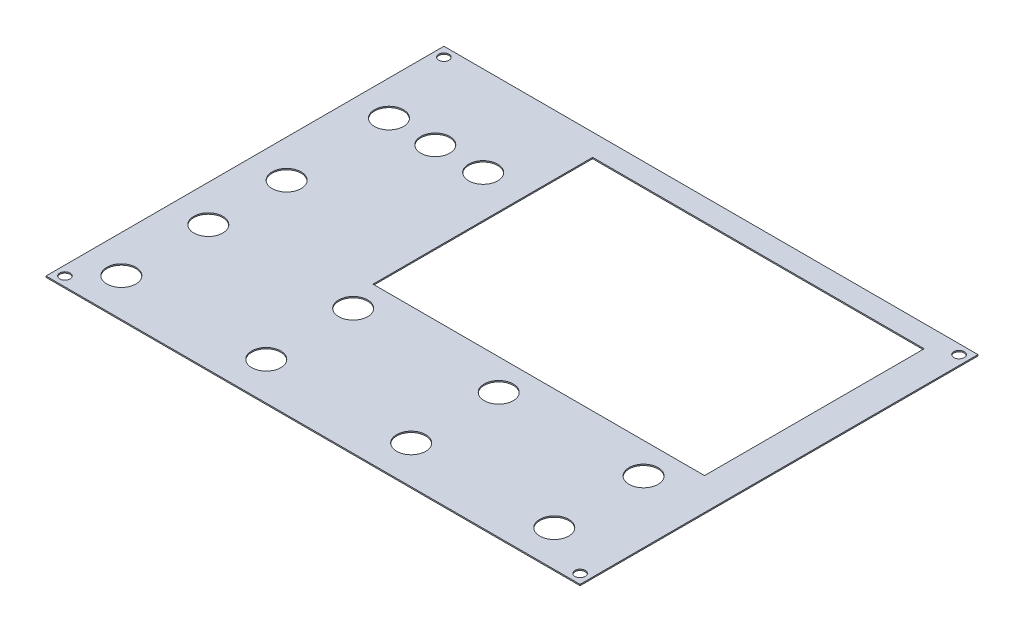
from build123d import *

# Parameters (mm, degrees)
SKETCH1_W           = 128.872
SKETCH1_H           = 96.012
SKETCH1_R           = 1.25
SKETCH1_R_2         = 3.5
SKETCH1_W_2         = 80
SKETCH1_H_2         = 53
BOSS_EXTRUDE1_DEPTH = 0.3


with BuildPart() as part:
    # Sketch1 → Boss-Extrude1 (new body)
    with BuildSketch(Plane(origin=(0, 0, 0), x_dir=(1, 0, 0), z_dir=(0, 1, 0))):
        with Locations((62.15, 45.72)):
            Rectangle(SKETCH1_W, SKETCH1_H)
        with Locations(Location((0, 91.44, 0), (0, 0, 270))):
            Circle(SKETCH1_R, mode=Mode.SUBTRACT)
        with Locations(Location((124.3, 91.44, 0), (0, 0, 270))):
            Circle(SKETCH1_R, mode=Mode.SUBTRACT)
        with Locations(Location((0, 0, 0), (0, 0, 270))):
            Circle(SKETCH1_R, mode=Mode.SUBTRACT)
        with Locations(Location((124.3, 0, 0), (0, 0, 270))):
            Circle(SKETCH1_R, mode=Mode.SUBTRACT)
        with Locations(Location((6.731, 6.881, 0), (0, 0, 270))):
            Circle(SKETCH1_R_2, mode=Mode.SUBTRACT)
        with Locations(Location((41.697, 6.881, 0), (0, 0, 270))):
            Circle(SKETCH1_R_2, mode=Mode.SUBTRACT)
        with Locations(Location((76.663, 6.881, 0), (0, 0, 270))):
            Circle(SKETCH1_R_2, mode=Mode.SUBTRACT)
        with Locations(Location((111.63, 6.44, 0), (0, 0, 270))):
            Circle(SKETCH1_R_2, mode=Mode.SUBTRACT)
        with Locations(Location((6.73, 46.754, 0), (0, 0, 270))):
            Circle(SKETCH1_R_2, mode=Mode.SUBTRACT)
        with Locations(Location((6.568, 28.023, 0), (0, 0, 270))):
            Circle(SKETCH1_R_2, mode=Mode.SUBTRACT)
        with Locations(Location((41.524, 28.023, 0), (0, 0, 270))):
            Circle(SKETCH1_R_2, mode=Mode.SUBTRACT)
        with Locations(Location((76.645, 28.023, 0), (0, 0, 270))):
            Circle(SKETCH1_R_2, mode=Mode.SUBTRACT)
        with Locations(Location((111.601, 28.023, 0), (0, 0, 270))):
            Circle(SKETCH1_R_2, mode=Mode.SUBTRACT)
        with Locations(Location((6.096, 72.09, 0), (0, 0, 270))):
            Circle(SKETCH1_R_2, mode=Mode.SUBTRACT)
        with Locations(Location((17.272, 72.09, 0), (0, 0, 270))):
            Circle(SKETCH1_R_2, mode=Mode.SUBTRACT)
        with Locations(Location((28.83, 72.09, 0), (0, 0, 270))):
            Circle(SKETCH1_R_2, mode=Mode.SUBTRACT)
        with Locations((78.875410923, 61.951987271)):
            Rectangle(SKETCH1_W_2, SKETCH1_H_2, mode=Mode.SUBTRACT)
    extrude(amount=BOSS_EXTRUDE1_DEPTH)


solid = part.part
